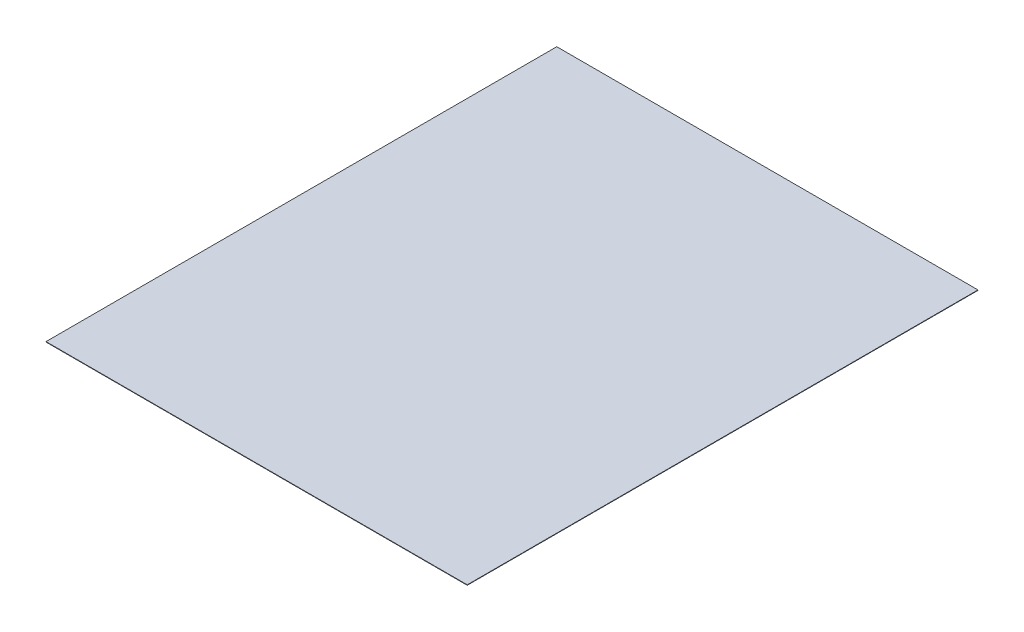
from build123d import *

# Parameters (mm, degrees)
SKETCH_1_W      = 1000
SKETCH_1_H      = 1212.5
EXTRUDE_1_DEPTH = 1


with BuildPart() as part:
    # Эскиз1 → Бобышка-Вытянуть1 (new body)
    with BuildSketch(Plane(origin=(0, 0, 0), x_dir=(1, 0, 0), z_dir=(0, 1, 0))):
        Rectangle(SKETCH_1_W, SKETCH_1_H)
    extrude(amount=EXTRUDE_1_DEPTH)


solid = part.part
